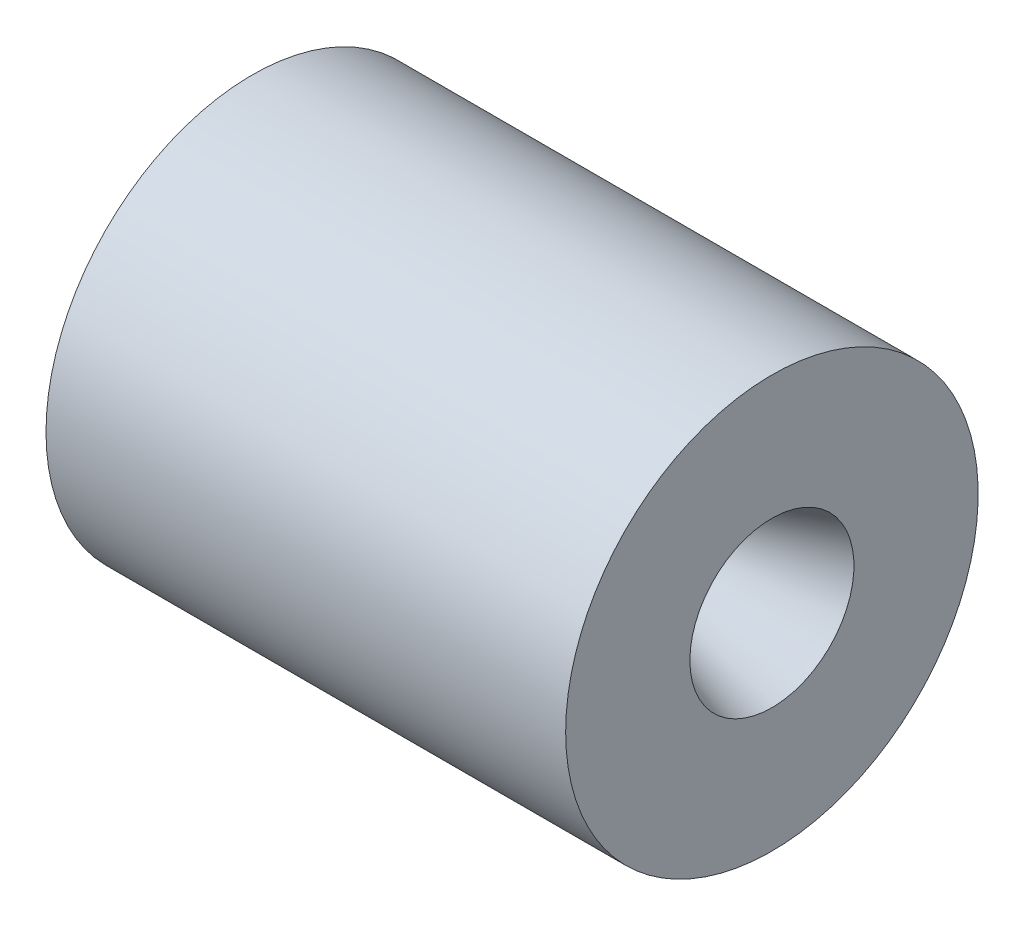
from build123d import *


with BuildPart() as part:
    # Model → Revolve1 (revolve)
    with BuildSketch(Plane.XY, mode=Mode.PRIVATE) as revolve1_sk:
        with BuildLine():
            Line((0, 56.499761536), (23.721747443, 56.499761536))
            ThreePointArc((23.721747443, 56.499761536), (61.910828562, 51.472073195), (97.497386789, 36.731637642))
            Line((97.497386789, 36.731637642), (131.736780289, 16.963514588))
            ThreePointArc((131.736780289, 16.963514588), (136.846780231, 14.84688352), (142.330485577, 14.124940199))
            ThreePointArc((142.330485577, 14.124940199), (143.215010337, 14.197934269), (144.075603175, 14.414941534))
            add(Edge.make_bspline(
                [(144.075603175, 14.414941534), (185.934060843, 28.722002721), (190.226374917, 30.032918805)],
                knots=[0, 0, 0, 1, 1, 1], degree=2))
            Line((190.226374917, 30.032918805), (190.226374917, 75.499761536))
            Line((190.226374917, 75.499761536), (0, 75.499761536))
            Line((0, 75.499761536), (0, 56.499761536))
        make_face()
    revolve(revolve1_sk.sketch.rotate(Axis((0, 0, 0), (1, 0, 0)), 90), axis=Axis((0, 0, 0), (1, 0, 0)))


solid = part.part
